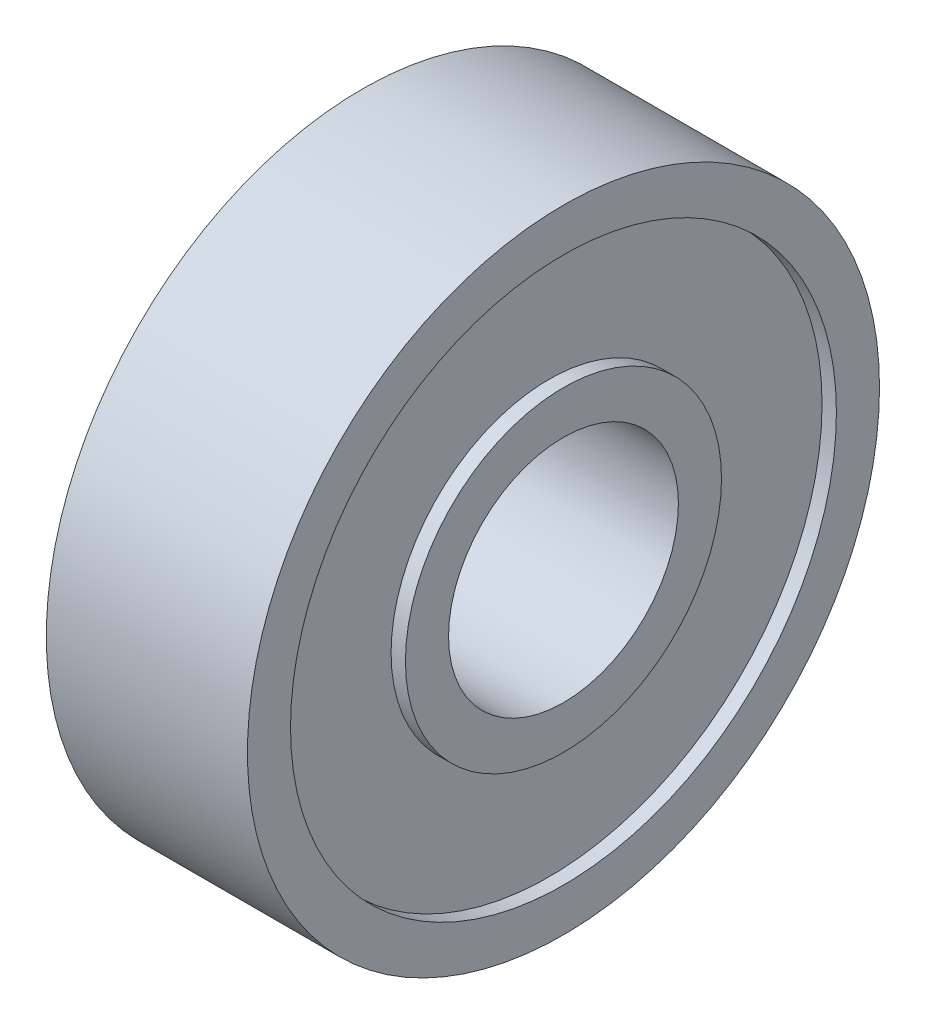
from build123d import *

# Parameters (mm, degrees)
ESQUISSE1_R          = 11
ESQUISSE1_R_2        = 9.5
BOSS_EXTRU_1_DEPTH   = 3.5
ESQUISSE1_R_3        = 5.5
ESQUISSE1_R_4        = 4
BOSS_EXTRU_1_2_DEPTH = 3.5
ESQUISSE2_R          = 11
ESQUISSE2_R_2        = 5.5
BOSS_EXTRU_2_DEPTH   = 3


with BuildPart() as part:
    # Esquisse1 → Boss.-Extru.1 (new, symmetric)
    with BuildSketch(Plane(origin=(0, 0, 0), x_dir=(0, 0, -1), z_dir=(1, 0, 0))):
        Circle(ESQUISSE1_R)
        Circle(ESQUISSE1_R_2, mode=Mode.SUBTRACT)
    extrude(amount=BOSS_EXTRU_1_DEPTH, both=True)



with BuildPart() as body_2:
    # Esquisse1 → Boss.-Extru.1 2 (new, symmetric)
    with BuildSketch(Plane(origin=(0, 0, 0), x_dir=(0, 0, -1), z_dir=(1, 0, 0))):
        Circle(ESQUISSE1_R_3)
        Circle(ESQUISSE1_R_4, mode=Mode.SUBTRACT)
    extrude(amount=BOSS_EXTRU_1_2_DEPTH, both=True)


with BuildPart() as part_1:
    add(part.part)

    add(body_2.part)  # Boss.-Extru.2 merges body 2
    # Esquisse2 → Boss.-Extru.2 (add, symmetric)
    with BuildSketch(Plane(origin=(0, 0, 0), x_dir=(0, 0, -1), z_dir=(1, 0, 0))):
        Circle(ESQUISSE2_R)
        Circle(ESQUISSE2_R_2, mode=Mode.SUBTRACT)
    extrude(amount=BOSS_EXTRU_2_DEPTH, both=True)


solid = part_1.part
